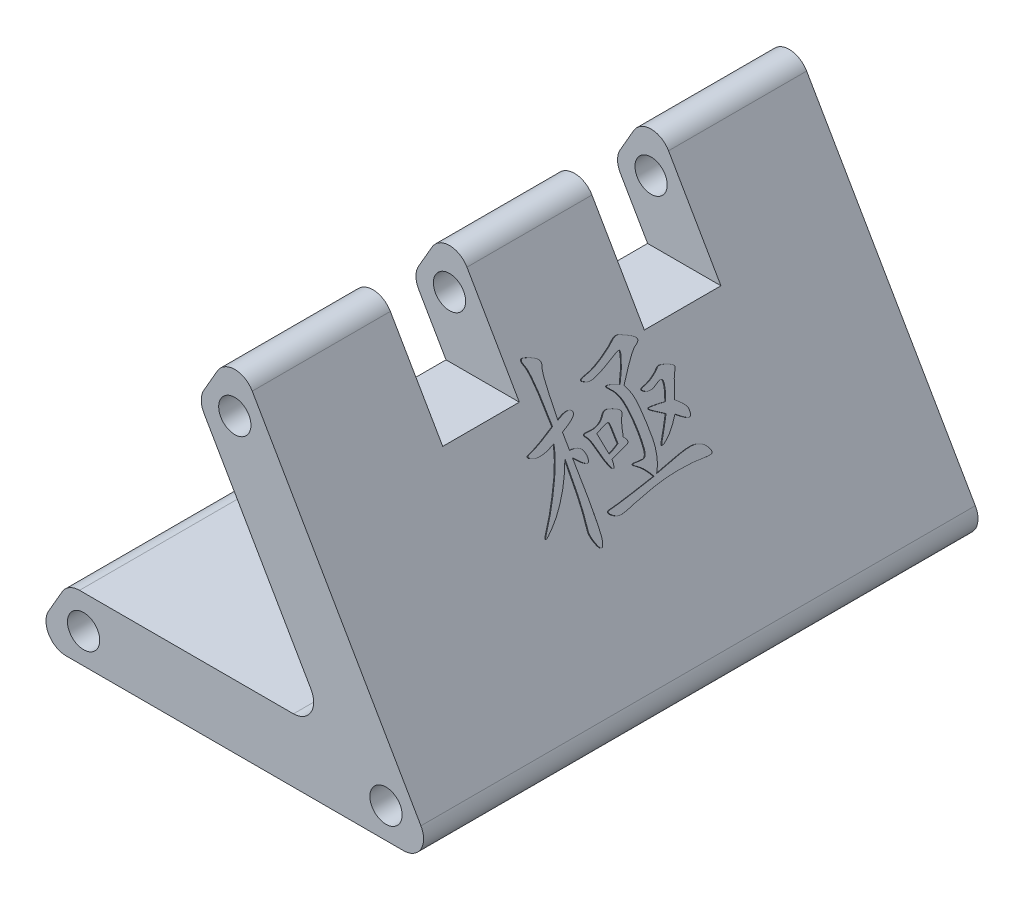
from build123d import *

# Parameters (mm, degrees)
SKETCH_1_R          = 1.6
EXTRUDE_1_DEPTH     = 27.5
FILLET_1_R          = 2
CUT_EXTRUDE_1_DEPTH = 66.5
FILLET_2_R          = 2
EXTRUDE_2_DEPTH     = 0.1
SKETCH_4_W          = 7.6
SKETCH_4_H          = 20
CUT_EXTRUDE_2_DEPTH = 25


with BuildPart() as part:
    # 草图1 → 凸台-拉伸1 (new, symmetric)
    with BuildSketch(Plane.XY):
        Polygon((20.196152423, -28.980762114), (0, 6), (-20.196152423, -28.980762114), align=None)
        Circle(SKETCH_1_R, mode=Mode.SUBTRACT)
        with Locations((-15, -25.980762114)):
            Circle(SKETCH_1_R, mode=Mode.SUBTRACT)
        with Locations((15, -25.980762114)):
            Circle(SKETCH_1_R, mode=Mode.SUBTRACT)
    extrude(amount=EXTRUDE_1_DEPTH, both=True)

    # 圆角1
    fillet_1_edges = [part.edges().sort_by_distance(p)[0] for p in [
        (-20.196152423, -28.980762114, 0),
        (0, 6, 0),
        (20.196152423, -28.980762114, 0),
    ]]
    fillet(fillet_1_edges, radius=FILLET_1_R)

    # 草图2 → 切除-拉伸1 (cut, symmetric)
    with BuildSketch(Plane(origin=(0, 0, -27.5), x_dir=(-1, 0, 0), z_dir=(0, 0, -1))):
        Polygon((3.637306696, -0.3), (-9.284232335, -22.680762114), (16.558845727, -22.680762114), align=None)
    extrude(amount=CUT_EXTRUDE_1_DEPTH, both=True, mode=Mode.SUBTRACT)

    # 圆角2
    fillet_2_edges = [part.edges().sort_by_distance(p)[0] for p in [
        (-3.637306696, -0.3, 0),
        (-16.558845727, -22.680762114, 0),
        (9.284232335, -22.680762114, 0),
    ]]
    fillet(fillet_2_edges, radius=FILLET_2_R)

    # 草图3 → 凸台-拉伸2 (add, symmetric)
    # profile 1 of 4: a face of its own
    with BuildSketch(Plane(origin=(2.598076211, 1.5, 0), x_dir=(0, 0, -1), z_dir=(0.8660254037844386, 0.5000000000000001, 0))):
        with BuildLine():
            add(Edge.make_bspline(
                [(2.736842105, -11.381173615), (2.801991454, -11.497126082), (2.929682208, -11.724389415), (3.085120059, -12.075523331), (3.193718681, -12.429488031), (3.256485862, -12.730112981), (3.29011482, -12.987916168), (3.313186965, -13.214143189), (3.333687441, -13.474998217), (3.351654391, -13.769617528), (3.366127131, -14.098938608), (3.383626882, -14.460960907), (3.391125932, -14.85791078), (3.40520759, -15.278842295), (3.401922108, -15.705724223), (3.371922554, -16.119384477), (3.311446119, -16.509218732), (3.22833647, -16.878342951), (3.108315326, -17.221984812), (2.97041173, -17.545865882), (2.800400711, -17.846024644), (2.66432259, -18.027536725), (2.596491228, -18.11801572)],
                knots=[0, 0, 0, 0, 1.136628238, 2.227757004, 3.274841286, 4.295935326, 4.848963795, 5.496727819, 6.239698062, 7.085576876, 8.019795436, 9.057592931, 10.183700872, 11.413460527, 12.657763562, 13.831288076, 14.955177659, 16.027648076, 17.060492108, 18.062143739, 19.034029657, 20, 20, 20, 20], degree=3))
            add(Edge.make_bspline(
                [(2.596491228, -18.11801572), (2.853723167, -18.073369607), (3.344469328, -17.988193914), (4.046248622, -17.873796403), (4.677787517, -17.777021229), (5.160558019, -17.709898794), (5.510465418, -17.664854849), (5.745500236, -17.644485104), (5.962150749, -17.631251498), (6.159835357, -17.624789808), (6.339436685, -17.630335574), (6.499889707, -17.643120636), (6.6430527, -17.661674597), (6.805396405, -17.704877093), (6.987636527, -17.770881177), (7.184213208, -17.876630845), (7.361237511, -18.000934423), (7.508902952, -18.148444398), (7.629703359, -18.301723709), (7.720700796, -18.452609383), (7.777439867, -18.60188845), (7.785557085, -18.701521307), (7.789473684, -18.749594667)],
                knots=[0, 0, 0, 0, 2.716065202, 5.181699354, 7.39712167, 9.362635088, 10.252514407, 11.066890192, 11.816332215, 12.510573645, 13.123728299, 13.684353632, 14.185289706, 14.622493898, 15.429504603, 16.195616628, 16.938471817, 17.67141889, 18.358367172, 18.964325239, 19.500281664, 20, 20, 20, 20], degree=3))
            add(Edge.make_bspline(
                [(7.789473684, -18.749594667), (7.785975484, -18.766222387), (7.778416926, -18.802149885), (7.724299236, -18.839168236), (7.648908836, -18.864093288), (7.542635128, -18.873225444), (7.409197832, -18.879543713), (7.245764183, -18.869913791), (7.053732827, -18.847504464), (6.748181589, -18.807909918), (6.321522729, -18.749974838), (5.761877872, -18.709216123), (5.145600849, -18.682659521), (4.715650315, -18.680530512), (4.49122807, -18.679419229)],
                knots=[0, 0, 0, 0, 0.176134878, 0.380574459, 0.656581553, 1.030796211, 1.513875527, 2.090102544, 2.781056321, 3.585908988, 5.391351152, 7.393452033, 9.595509816, 12, 12, 12, 12], degree=3))
            add(Edge.make_bspline(
                [(4.49122807, -18.679419229), (4.265924864, -18.682040004), (3.809795623, -18.687345796), (3.116121084, -18.727463093), (2.405586922, -18.796215158), (1.806499715, -18.871507286), (1.333039295, -18.939984395), (0.996369129, -18.993363432), (0.679761984, -19.041226097), (0.383793524, -19.091774501), (0.108768487, -19.137226777), (-0.14501372, -19.184523926), (-0.377897351, -19.231409879), (-0.651183967, -19.288128695), (-0.950870391, -19.352215833), (-1.270047941, -19.38905987), (-1.531946812, -19.409004229), (-1.747892364, -19.38809461), (-1.933123425, -19.336747723), (-2.101801713, -19.250224728), (-2.268952645, -19.139514464), (-2.397434763, -19.026173266), (-2.4836505, -18.929927938), (-2.52480624, -18.865513298), (-2.539060715, -18.806485511), (-2.522260641, -18.751748373), (-2.468818811, -18.717221098), (-2.394316116, -18.697014554), (-2.293842533, -18.681076495), (-2.21796165, -18.680014412), (-2.175438596, -18.679419229)],
                knots=[0, 0, 0, 0, 2.452300227, 4.964713367, 7.560189569, 10.221188635, 11.536149432, 12.767176317, 13.931526762, 15.02139617, 16.035305026, 16.965648597, 17.831172724, 18.620890509, 20.004269363, 21.163414613, 22.117029218, 22.856441957, 23.513178025, 24.19639443, 24.910415406, 25.691983384, 26.053049708, 26.315066214, 26.516660444, 26.695585537, 26.897400209, 27.174750135, 27.537536417, 28, 28, 28, 28], degree=3))
            add(Edge.make_bspline(
                [(-2.175438596, -18.679419229), (-2.147713216, -18.678618123), (-2.083574816, -18.676764889), (-1.973456389, -18.671782131), (-1.837534815, -18.66057375), (-1.67470078, -18.647200399), (-1.486332698, -18.633627655), (-1.272073007, -18.606769029), (-1.030782853, -18.586000119), (-0.763145999, -18.556579951), (-0.469598981, -18.522352552), (-0.149066092, -18.485761979), (0.197698245, -18.447825113), (0.571035332, -18.403012029), (0.969440089, -18.353501851), (1.394770315, -18.301069982), (1.846373581, -18.247484583), (2.156403889, -18.208323662), (2.315789474, -18.188191158)],
                knots=[0, 0, 0, 0, 0.294626454, 0.681572966, 1.170697032, 1.743109613, 2.41716358, 3.176307068, 4.036145648, 4.98940191, 6.036152897, 7.175379315, 8.416227613, 9.741463661, 11.169407057, 12.680677635, 14.293547043, 16, 16, 16, 16], degree=3))
            add(Edge.make_bspline(
                [(2.315789474, -18.188191158), (2.235201176, -18.055623904), (2.081101101, -17.802130226), (1.819483938, -17.466074098), (1.553183261, -17.182768823), (1.317632044, -16.998768193), (1.147390475, -16.87903752), (1.054292788, -16.804369993), (0.996495182, -16.7441399), (0.959000838, -16.697119269), (0.968341377, -16.646303045), (1.024513843, -16.632417303), (1.09706398, -16.632969304), (1.235563137, -16.648700084), (1.415728403, -16.676796554), (1.622556552, -16.695850571), (1.80270064, -16.710378726), (1.913771824, -16.713205444), (1.964912281, -16.714506948)],
                knots=[0, 0, 0, 0, 2.421572679, 4.630505212, 6.640478363, 8.47927966, 9.283237027, 9.898374733, 10.329111469, 10.607781406, 10.788339595, 11.024690413, 11.403867442, 11.9613716, 13.176744018, 14.264816593, 15.201070272, 16, 16, 16, 16], degree=3))
            add(Edge.make_bspline(
                [(1.964912281, -16.714506948), (2.009804267, -16.71001934), (2.099949377, -16.701008023), (2.212660918, -16.606651136), (2.300240084, -16.469699956), (2.344498769, -16.318648037), (2.378638085, -16.173120497), (2.39784197, -16.037279254), (2.415803648, -15.882167641), (2.431916707, -15.708035614), (2.441276138, -15.513791458), (2.449057476, -15.299783889), (2.454204917, -15.065839447), (2.455479346, -14.903809756), (2.456140351, -14.819770106)],
                knots=[0, 0, 0, 0, 0.758365101, 1.522830919, 2.413832335, 3.528496084, 4.199585751, 4.982068385, 5.8804867, 6.880949527, 7.983140702, 9.218386144, 10.557265302, 12, 12, 12, 12], degree=3))
            add(Edge.make_bspline(
                [(2.456140351, -14.819770106), (2.454455783, -14.635175765), (2.451139057, -14.271729962), (2.415648542, -13.735907981), (2.362130041, -13.217962702), (2.286590132, -12.723411001), (2.184486463, -12.26227825), (2.030838874, -11.852355675), (1.834447433, -11.496553873), (1.627858097, -11.255379139), (1.467614739, -11.095030595), (1.37967094, -10.993325707), (1.322491322, -10.909897508), (1.287320778, -10.849366499), (1.28454722, -10.79372499), (1.329257548, -10.765194645), (1.393990309, -10.770591358), (1.517914332, -10.792780711), (1.70127659, -10.849708001), (1.938123663, -10.934014775), (2.19296252, -11.042420104), (2.365561727, -11.126514999), (2.456140351, -11.170647299)],
                knots=[0, 0, 0, 0, 1.990218653, 3.918520012, 5.787921151, 7.603368328, 9.311926223, 10.870042153, 12.309211141, 13.669217195, 14.277100266, 14.754371079, 15.117152714, 15.363791294, 15.513556588, 15.653688124, 15.868759472, 16.200502776, 17.016641159, 17.929733103, 18.913541207, 20, 20, 20, 20], degree=3))
            add(Edge.make_bspline(
                [(2.456140351, -11.170647299), (2.534044382, -11.056817564), (2.685811723, -10.835062208), (2.892979171, -10.504325767), (3.073416264, -10.186067563), (3.225036981, -9.886748704), (3.344278162, -9.616784058), (3.433945315, -9.39144546), (3.492325763, -9.213673235), (3.503940381, -9.108948455), (3.50877193, -9.065384141)],
                knots=[0, 0, 0, 0, 1.396397204, 2.720366181, 3.949753812, 5.099092354, 6.116144513, 6.935449391, 7.557159084, 8, 8, 8, 8], degree=3))
            add(Edge.make_bspline(
                [(3.50877193, -9.065384141), (3.506306125, -9.049644632), (3.501362765, -9.018090605), (3.454362522, -8.984932657), (3.386578694, -8.980481266), (3.297516094, -8.986262309), (3.183410754, -9.008951716), (3.045013615, -9.048729985), (2.880467356, -9.104016546), (2.501963711, -9.24678581), (1.930349285, -9.463826004), (1.298134346, -9.657906761), (0.835288948, -9.788445462), (0.544391506, -9.843016806), (0.307036104, -9.880801343), (0.11208528, -9.879610737), (-0.053336801, -9.848935209), (-0.205162793, -9.795996215), (-0.352124077, -9.721542215), (-0.46618343, -9.647672742), (-0.543855587, -9.585774808), (-0.57365535, -9.535453971), (-0.567770204, -9.481849763), (-0.520380617, -9.443414285), (-0.44926341, -9.414214062), (-0.35035741, -9.386256765), (-0.22061869, -9.364008087), (-0.00041358, -9.338237998), (0.313315575, -9.295435098), (0.717959194, -9.198690776), (1.15589734, -9.061475912), (1.613783614, -8.895654898), (2.056628054, -8.710708771), (2.457693649, -8.533707677), (2.796823091, -8.363801835), (3.073207799, -8.199742995), (3.302106622, -8.05626023), (3.511771881, -7.976831392), (3.697669599, -7.942457788), (3.867168224, -7.974224814), (4.030821698, -8.049732407), (4.225007872, -8.139627042), (4.451916285, -8.260602346), (4.699308791, -8.396906876), (4.934097264, -8.535696734), (5.119149013, -8.67256416), (5.243629288, -8.794526461), (5.30783066, -8.916845227), (5.291449976, -9.039385844), (5.204922471, -9.14389585), (5.060780839, -9.234456109), (4.895192498, -9.300166288), (4.722803761, -9.388717029), (4.55443195, -9.519342268), (4.343204056, -9.695379004), (4.097426819, -9.930387323), (3.809044003, -10.214752914), (3.485763687, -10.556137437), (3.123546742, -10.950234479), (2.870816269, -11.23187437), (2.736842105, -11.381173615)],
                knots=[0, 0, 0, 0, 0.184364429, 0.369607487, 0.633022986, 0.987380221, 1.442441407, 2.025545752, 2.716471861, 3.526270317, 6.883648343, 10.055881053, 11.466650148, 12.654198181, 13.609184751, 14.347962371, 14.982623857, 15.620941895, 16.272353277, 16.956271921, 17.250917204, 17.460299435, 17.628063516, 17.848771766, 18.146705195, 18.558299617, 19.076637796, 19.727051356, 21.220528632, 22.876118409, 24.715795186, 26.730039288, 28.722073042, 30.477809904, 31.994696383, 33.272349563, 34.339588, 35.228530643, 35.953926582, 36.576534257, 37.26242852, 38.114119639, 39.147239634, 40.348788354, 41.506846688, 42.420352537, 43.104903999, 43.594016143, 44.013426347, 44.504526312, 45.171131808, 46.041679059, 46.642070409, 47.491151998, 48.59150062, 49.945897393, 51.571798143, 53.455692421, 55.59103127, 58, 58, 58, 58], degree=3))
        make_face()
    # profile 2 of 4: a face of its own
    with BuildSketch(Plane(origin=(2.598076211, 1.5, 0), x_dir=(0, 0, -1), z_dir=(0.8660254037844386, 0.5000000000000001, 0))):
        with BuildLine():
            add(Edge.make_bspline(
                [(-3.719298246, -11.170647299), (-3.646765375, -11.14310885), (-3.507879924, -11.090378414), (-3.305657252, -11.025747194), (-3.121044857, -10.97553713), (-2.954472415, -10.941191525), (-2.804908681, -10.921355753), (-2.67271089, -10.919541807), (-2.556187397, -10.92614513), (-2.435569869, -10.964841855), (-2.318898455, -11.021198987), (-2.226198575, -11.126742326), (-2.21846925, -11.260819899), (-2.269065728, -11.370213756), (-2.34514505, -11.463986214), (-2.446073716, -11.535437363), (-2.572093516, -11.62160398), (-2.738793538, -11.699869611), (-2.933216937, -11.793994511), (-3.165514297, -11.884767028), (-3.430425325, -11.984109414), (-3.619479497, -12.048781679), (-3.719298246, -12.082928001)],
                knots=[0, 0, 0, 0, 1.344132713, 2.573736254, 3.677086762, 4.657469661, 5.519577382, 6.285332407, 6.948580662, 7.528048509, 8.468542532, 9.174262403, 9.837510658, 10.66548297, 11.209444983, 11.915164854, 12.793714883, 13.854474535, 15.0969319, 16.538154299, 18.172179431, 20, 20, 20, 20], degree=3))
            Line((-3.719298246, -12.082928001), (-3.719298246, -13.486436772))
            add(Edge.make_bspline(
                [(-3.719298246, -13.486436772), (-3.646366691, -13.492999619), (-3.507569874, -13.505489443), (-3.312146948, -13.542413416), (-3.137966078, -13.589023679), (-2.984625629, -13.646207201), (-2.855057515, -13.721724829), (-2.743831286, -13.803415872), (-2.655221848, -13.901166519), (-2.576642018, -14.046425548), (-2.509206157, -14.228889608), (-2.467505064, -14.446870705), (-2.469917715, -14.658854055), (-2.505108954, -14.819370993), (-2.565521204, -14.937996039), (-2.665312402, -14.957663507), (-2.776878536, -14.92248545), (-2.910852182, -14.838581983), (-3.074756528, -14.712855314), (-3.264381436, -14.534684561), (-3.483563034, -14.309157148), (-3.636726758, -14.139372311), (-3.719298246, -14.047840281)],
                knots=[0, 0, 0, 0, 1.171328436, 2.229167592, 3.177681634, 4.05567862, 4.838162783, 5.570257416, 6.257660978, 6.928361689, 8.200624651, 9.356422799, 10.465711916, 11.551884659, 12.021047472, 12.451533792, 13.036664375, 13.869028262, 14.967170212, 16.340998177, 18.027410028, 20, 20, 20, 20], degree=3))
            add(Edge.make_bspline(
                [(-3.719298246, -14.047840281), (-3.716535951, -14.269627552), (-3.711151725, -14.701932136), (-3.706017592, -15.331783727), (-3.703313478, -15.926113009), (-3.703197967, -16.483191716), (-3.705837788, -17.004747462), (-3.710504472, -17.48993068), (-3.71951457, -17.93867112), (-3.725283205, -18.351161286), (-3.739270236, -18.72713451), (-3.753860177, -19.067699253), (-3.773599409, -19.372512349), (-3.788766863, -19.641510862), (-3.814307003, -19.873388402), (-3.835168398, -20.069834007), (-3.863766263, -20.229260539), (-3.89974126, -20.386437974), (-3.94844462, -20.536036941), (-4.016441227, -20.669409596), (-4.079483611, -20.764390815), (-4.166681789, -20.802498963), (-4.257041723, -20.773867912), (-4.33354269, -20.689715554), (-4.417627876, -20.565106148), (-4.521805895, -20.33458207), (-4.641621584, -20.035540409), (-4.730647964, -19.687859489), (-4.773181843, -19.378976607), (-4.742031308, -19.094707935), (-4.679315865, -18.805327147), (-4.627027871, -18.467015299), (-4.57640279, -18.067302918), (-4.532933097, -17.689514239), (-4.499043232, -17.334182101), (-4.473134616, -17.003233399), (-4.45094791, -16.614080019), (-4.426764977, -16.168836386), (-4.407363225, -15.666232614), (-4.385506078, -15.107491416), (-4.368469688, -14.491433303), (-4.3569121, -14.061702228), (-4.350877193, -13.837313965)],
                knots=[0, 0, 0, 0, 1.899635201, 3.70274182, 5.394504534, 6.989791749, 8.473798405, 9.861406641, 11.145249343, 12.317811256, 13.394342094, 14.367373304, 15.237058707, 16.010478514, 16.674221123, 17.23470911, 17.70192975, 18.060090826, 18.616190495, 19.040945637, 19.346877623, 19.570093311, 19.800470217, 20.104959119, 20.526853049, 21.087684728, 22.26446484, 23.2830527, 24.15652815, 24.916302526, 25.716693682, 26.693790263, 27.846057099, 29.167744095, 29.950363181, 30.903009574, 32.010595707, 33.288571422, 34.721849667, 36.318240863, 38.077533643, 40, 40, 40, 40], degree=3))
            add(Edge.make_bspline(
                [(-4.350877193, -13.837313965), (-4.464832817, -14.049924), (-4.683326498, -14.457573462), (-5.031553044, -15.024694741), (-5.368699198, -15.530448202), (-5.707641464, -15.970800812), (-6.042307013, -16.359098037), (-6.369457435, -16.710014413), (-6.690709366, -17.027999914), (-7.009031996, -17.31004179), (-7.321938963, -17.558223833), (-7.623273983, -17.784299376), (-7.917714579, -17.979287042), (-8.150712175, -18.129074966), (-8.311880454, -18.20275346), (-8.387605435, -18.246306253), (-8.449375242, -18.215956796), (-8.409850324, -18.139622513), (-8.357294456, -18.054634808), (-8.25002931, -17.919805686), (-8.109364572, -17.748529959), (-7.843739483, -17.467234943), (-7.483543833, -17.05100448), (-7.033457941, -16.490861624), (-6.572889657, -15.85529027), (-6.180581485, -15.287985476), (-5.869749346, -14.813103819), (-5.654550387, -14.457323043), (-5.458700979, -14.110577839), (-5.282021677, -13.772468525), (-5.122398755, -13.444223411), (-4.987584472, -13.122417575), (-4.869613782, -12.811429226), (-4.803958107, -12.604785826), (-4.771929825, -12.503980632)],
                knots=[0, 0, 0, 0, 1.787555884, 3.427383828, 4.930558968, 6.290703403, 7.543012355, 8.728821377, 9.845853481, 10.892131491, 11.878943357, 12.806210884, 13.680680274, 14.5044263, 14.834677217, 15.02167184, 15.110881082, 15.249500525, 15.520420605, 15.932693883, 16.48437586, 17.179819094, 18.790892251, 20.56795618, 22.502211626, 24.607576366, 25.679799977, 26.708390678, 27.688872596, 28.630963227, 29.535677514, 30.393195816, 31.216165586, 32, 32, 32, 32], degree=3))
            add(Edge.make_bspline(
                [(-4.771929825, -12.503980632), (-4.890298556, -12.541464385), (-5.11786022, -12.613526196), (-5.449876389, -12.699572897), (-5.758655656, -12.761431589), (-6.043771474, -12.794802566), (-6.304623668, -12.807557502), (-6.541920184, -12.792628327), (-6.755454464, -12.752394957), (-6.94044614, -12.687610933), (-7.09068421, -12.613953662), (-7.20293297, -12.543733615), (-7.279727626, -12.486015217), (-7.314004214, -12.420340265), (-7.290790733, -12.356964066), (-7.220955483, -12.316852825), (-7.117346449, -12.281408209), (-6.969522709, -12.258020639), (-6.781151251, -12.222843138), (-6.554097658, -12.160094713), (-6.2851381, -12.082592994), (-5.976795726, -11.983147985), (-5.627270514, -11.863601727), (-5.238658953, -11.718827359), (-4.807141271, -11.559276976), (-4.507502058, -11.442312363), (-4.350877193, -11.381173615)],
                knots=[0, 0, 0, 0, 1.529679857, 2.940780802, 4.224155124, 5.40659462, 6.474964171, 7.437861128, 8.329732155, 9.143358556, 9.845163989, 10.387184599, 10.772822402, 11.02656803, 11.229114927, 11.534431934, 11.976775273, 12.586007998, 13.369014705, 14.339984805, 15.485215921, 16.818756485, 18.331166932, 20.036688515, 21.928331474, 24, 24, 24, 24], degree=3))
            add(Edge.make_bspline(
                [(-4.350877193, -11.381173615), (-4.351889362, -11.21570009), (-4.35386071, -10.893416332), (-4.354316265, -10.422933919), (-4.364398185, -9.978541106), (-4.369932116, -9.559991135), (-4.383982654, -9.167553437), (-4.399135799, -8.801049408), (-4.417402518, -8.45968327), (-4.437718238, -8.144264853), (-4.461274858, -7.854011565), (-4.486591646, -7.590516938), (-4.515385703, -7.352230069), (-4.545864231, -7.139765723), (-4.579616112, -6.952519283), (-4.614382743, -6.790501198), (-4.656077225, -6.655459656), (-4.709900532, -6.516009297), (-4.770846762, -6.37796413), (-4.810141129, -6.234678538), (-4.819508738, -6.122524032), (-4.787387662, -6.034840181), (-4.709321282, -5.987935748), (-4.602690645, -5.990799775), (-4.468953481, -6.022223429), (-4.25734765, -6.107117064), (-3.999779763, -6.226351154), (-3.725938942, -6.366392417), (-3.518815242, -6.501875398), (-3.37261774, -6.631201864), (-3.281889335, -6.758806592), (-3.239862248, -6.887352239), (-3.239555864, -7.019573275), (-3.290899404, -7.121577521), (-3.337166404, -7.216149881), (-3.368152251, -7.314696243), (-3.403342517, -7.435437531), (-3.433642228, -7.581518239), (-3.460227328, -7.752840234), (-3.493095798, -7.947275947), (-3.520946624, -8.165797728), (-3.546041817, -8.407720993), (-3.572951928, -8.672682634), (-3.595235333, -8.961370758), (-3.618665746, -9.273255096), (-3.64284064, -9.608443595), (-3.662278147, -9.966393514), (-3.684389077, -10.347484337), (-3.70133863, -10.751319185), (-3.713212944, -11.028565293), (-3.719298246, -11.170647299)],
                knots=[0, 0, 0, 0, 2.055143435, 4.002690769, 5.842893852, 7.575516859, 9.201131961, 10.719631905, 12.131172114, 13.446682748, 14.644936182, 15.747694076, 16.733960293, 17.62565864, 18.412888286, 19.096789699, 19.682184248, 20.165775575, 20.953005221, 21.553242013, 22.005280251, 22.333055991, 22.652423531, 23.061860544, 23.623227544, 24.358679379, 25.88497406, 27.150836614, 28.174429145, 28.951072589, 29.562867234, 30.09370658, 30.610287407, 31.155755536, 31.487917018, 31.920052575, 32.434387388, 33.050612994, 33.770553097, 34.587799632, 35.499336611, 36.505763026, 37.60852092, 38.806774354, 40.101572579, 41.492956333, 42.98029694, 44.553579285, 46.233791735, 48, 48, 48, 48], degree=3))
        make_face()
    # profile 3 of 4: a face of its own
    with BuildSketch(Plane(origin=(2.598076211, 1.5, 0), x_dir=(0, 0, -1), z_dir=(0.8660254037844386, 0.5000000000000001, 0))):
        with BuildLine():
            add(Edge.make_bspline(
                [(1.052631579, -14.60924379), (1.088815299, -14.647612832), (1.154717767, -14.717495492), (1.235552705, -14.82111952), (1.284877018, -14.915035511), (1.30537681, -14.999761022), (1.288720392, -15.076023742), (1.236109349, -15.136750027), (1.153302107, -15.178997834), (1.045367978, -15.210864675), (0.912947703, -15.236466524), (0.760200387, -15.270004424), (0.588696301, -15.313709649), (0.39619813, -15.355278212), (0.185876981, -15.410005475), (-0.046380437, -15.462424683), (-0.297181403, -15.525790491), (-0.471290807, -15.569221578), (-0.561403509, -15.59169993)],
                knots=[0, 0, 0, 0, 1.021282207, 1.86009117, 2.53531936, 3.065032368, 3.512676664, 3.989545277, 4.568019465, 5.289590219, 6.164850294, 7.17838702, 8.317685997, 9.591460977, 10.991141358, 12.525221823, 14.201581064, 16, 16, 16, 16], degree=3))
            add(Edge.make_bspline(
                [(-0.561403509, -15.59169993), (-0.563236756, -15.656684535), (-0.566618169, -15.776548246), (-0.582151464, -15.942713485), (-0.616008635, -16.078105503), (-0.652006024, -16.170857663), (-0.691494541, -16.221430588), (-0.731171654, -16.236647245), (-0.772164269, -16.213999158), (-0.814360932, -16.176309984), (-0.857287354, -16.112711167), (-0.909139316, -16.031490408), (-0.963679051, -15.924862531), (-1.044380881, -15.748341392), (-1.143735669, -15.494346821), (-1.261522493, -15.161126623), (-1.372712422, -14.79232373), (-1.471804031, -14.403254426), (-1.571285771, -14.028259112), (-1.690850674, -13.705032961), (-1.81386172, -13.443353547), (-1.932739442, -13.276740115), (-2.020869782, -13.177982037), (-2.051603282, -13.114753965), (-2.060180485, -13.057597316), (-2.02600225, -13.013451305), (-1.965558415, -12.994205494), (-1.884150334, -12.981403133), (-1.775708491, -12.984041276), (-1.599478479, -12.999783506), (-1.370178568, -13.019881912), (-1.102817878, -13.018890455), (-0.857367581, -12.988566), (-0.634762909, -12.930054065), (-0.432628153, -12.853951121), (-0.256636096, -12.752175586), (-0.094911898, -12.64316492), (0.029683935, -12.506677518), (0.149995994, -12.384372761), (0.280997923, -12.295984036), (0.421947137, -12.256261596), (0.569145987, -12.254695562), (0.73110418, -12.290799389), (0.916791479, -12.358303804), (1.133920735, -12.452937596), (1.326724348, -12.551651153), (1.4839494, -12.63744227), (1.577043876, -12.714541837), (1.651357684, -12.788175552), (1.69485639, -12.869977969), (1.714077234, -12.952582942), (1.709010606, -13.039068033), (1.672535817, -13.125171564), (1.610646219, -13.210746062), (1.538550895, -13.307941178), (1.468920551, -13.429372883), (1.39969391, -13.572185269), (1.329184067, -13.736895836), (1.260021333, -13.923708558), (1.189526603, -14.132502848), (1.119913319, -14.363232433), (1.075644095, -14.525100005), (1.052631579, -14.60924379)],
                knots=[0, 0, 0, 0, 1.144377244, 2.110796909, 2.927997373, 3.596746651, 3.844936337, 4.037786843, 4.284096277, 4.608234322, 5.04428548, 5.619613846, 6.308396647, 7.147490286, 9.03586261, 11.104459612, 13.366500281, 15.810932749, 18.171136568, 20.187554386, 21.871687062, 23.238155722, 23.781056443, 24.183566913, 24.473645103, 24.73595015, 25.084284292, 25.563023778, 26.188116797, 26.983259805, 28.679974407, 30.235158603, 31.679929419, 33.018557141, 34.278466635, 35.466103249, 36.591535084, 37.69116353, 38.704775958, 39.609838814, 40.434965205, 41.243156097, 42.17604239, 43.338056711, 44.71739291, 46.340161453, 47.153369986, 47.858165374, 48.462267853, 48.980637674, 49.465168574, 49.938782484, 50.479538192, 51.084217564, 51.794924666, 52.608133199, 53.542264503, 54.587266928, 55.759637022, 57.04692318, 58.464899068, 60, 60, 60, 60], degree=3))
        make_face()
        with BuildLine():
            add(Edge.make_bspline(
                [(-0.98245614, -13.416261334), (-0.948682808, -13.5930024), (-0.884931729, -13.926621641), (-0.794902399, -14.396545484), (-0.71241574, -14.80478224), (-0.657022803, -15.055489123), (-0.631578947, -15.170647299)],
                knots=[0, 0, 0, 0, 1.206823894, 2.278019932, 3.20903614, 4, 4, 4, 4], degree=3))
            add(Edge.make_bspline(
                [(-0.631578947, -15.170647299), (-0.565586071, -15.154758613), (-0.417776127, -15.11917135), (-0.176172237, -15.045810465), (0.107904953, -14.94200818), (0.311193472, -14.862653937), (0.421052632, -14.819770106)],
                knots=[0, 0, 0, 0, 0.733245963, 1.64231431, 2.725882946, 4, 4, 4, 4], degree=3))
            add(Edge.make_bspline(
                [(0.421052632, -14.819770106), (0.421307284, -14.725335208), (0.421793237, -14.545124788), (0.41853673, -14.28955463), (0.415889391, -14.062565838), (0.413951011, -13.864150057), (0.409343985, -13.694253632), (0.40093458, -13.552283175), (0.393545208, -13.439448313), (0.384564934, -13.333079261), (0.366868026, -13.230306503), (0.293269362, -13.145558469), (0.185987113, -13.11276408), (0.052198365, -13.137162244), (-0.120729585, -13.18614809), (-0.354343512, -13.243549752), (-0.646773929, -13.326656173), (-0.8636604, -13.384550653), (-0.98245614, -13.416261334)],
                knots=[0, 0, 0, 0, 1.5062814, 2.874441638, 4.076782357, 5.12712452, 6.039603481, 6.786985338, 7.396437214, 7.840587326, 8.497539623, 9.016262154, 9.540659954, 10.207565547, 11.149395449, 12.41970034, 14.038953987, 16, 16, 16, 16], degree=3))
        make_face(mode=Mode.SUBTRACT)
    # profile 4 of 4: a face of its own
    with BuildSketch(Plane(origin=(2.598076211, 1.5, 0), x_dir=(0, 0, -1), z_dir=(0.8660254037844386, 0.5000000000000001, 0))):
        with BuildLine():
            add(Edge.make_bspline(
                [(6.385964912, -14.11801572), (6.451957025, -14.175016527), (6.577353184, -14.283327686), (6.753319731, -14.440053003), (6.900050226, -14.592095817), (7.020625788, -14.734832155), (7.123413359, -14.863274315), (7.192942599, -14.987103109), (7.243606011, -15.098665716), (7.268587104, -15.23106996), (7.27095948, -15.373720013), (7.254464821, -15.524716512), (7.203527157, -15.644318006), (7.141446251, -15.728449925), (7.057771263, -15.76115729), (6.971897369, -15.737881324), (6.865001977, -15.696161943), (6.733793376, -15.620594959), (6.576139237, -15.518543612), (6.396373315, -15.381603434), (6.187391704, -15.218274578), (6.042453261, -15.09581264), (5.964912281, -15.030296422)],
                knots=[0, 0, 0, 0, 1.548831541, 2.943041473, 4.183588614, 5.296789268, 6.263118343, 7.097149911, 7.814426171, 8.427018038, 9.473792862, 10.344218317, 11.095827042, 11.771809223, 12.132011848, 12.615176385, 13.292383332, 14.187616017, 15.28873432, 16.630502992, 18.197344366, 20, 20, 20, 20], degree=3))
            add(Edge.make_bspline(
                [(5.964912281, -15.030296422), (5.839173325, -15.174729837), (5.597061088, -15.452838533), (5.208091655, -15.816202155), (4.822736839, -16.123393517), (4.497639555, -16.32393242), (4.263552575, -16.449422494), (4.125494674, -16.50866523), (4.03248732, -16.538784782), (3.958054783, -16.550663072), (3.923667508, -16.496789735), (3.960599305, -16.426396549), (4.016301779, -16.334917857), (4.152965902, -16.160149474), (4.362824635, -15.90227052), (4.635663169, -15.54040077), (4.941397585, -15.128807741), (5.151863004, -14.834859921), (5.263157895, -14.679419229)],
                knots=[0, 0, 0, 0, 1.891929086, 3.642937685, 5.25340187, 6.757660554, 7.405049174, 7.888613328, 8.219202083, 8.41636847, 8.539885434, 8.762229166, 9.123559934, 9.637421568, 10.929476779, 12.42657502, 14.110359672, 16, 16, 16, 16], degree=3))
            add(Edge.make_bspline(
                [(5.263157895, -14.679419229), (5.190500295, -14.629866413), (5.039430456, -14.526836091), (4.801022527, -14.369303609), (4.548908866, -14.193281669), (4.327627066, -14.049517088), (4.167833792, -13.932532851), (4.079275227, -13.857233114), (4.027621693, -13.799151657), (3.998074661, -13.743021546), (4.034065664, -13.697632971), (4.100741506, -13.685582236), (4.195844594, -13.685146011), (4.480736711, -13.71254463), (4.95747364, -13.78472505), (5.388986791, -13.865409704), (5.614035088, -13.907489404)],
                knots=[0, 0, 0, 0, 1.145609563, 2.381953899, 3.721674878, 5.152104561, 5.813426268, 6.309208874, 6.645881368, 6.860004646, 7.03844071, 7.298981807, 7.716689925, 8.282757073, 11.018269823, 14, 14, 14, 14], degree=3))
            add(Edge.make_bspline(
                [(5.614035088, -13.907489404), (5.678101471, -13.775716212), (5.796764543, -13.531647309), (5.936835551, -13.183018481), (6.027598502, -12.882129499), (6.069703178, -12.662539538), (6.072071903, -12.51501489), (6.046541252, -12.431998308), (5.99542952, -12.36979991), (5.916574978, -12.339458535), (5.817486186, -12.33687177), (5.699003248, -12.361339493), (5.556362632, -12.402660762), (5.40109779, -12.471530709), (5.237752165, -12.542328232), (5.072286348, -12.590135418), (4.916486849, -12.626710269), (4.76606506, -12.639295475), (4.623727205, -12.634764266), (4.487567546, -12.611696987), (4.361198918, -12.56685387), (4.246110966, -12.508379035), (4.152698583, -12.443611386), (4.080966657, -12.384791338), (4.041342171, -12.330079316), (4.026069327, -12.273837158), (4.06256572, -12.228884185), (4.120531879, -12.197323661), (4.206932194, -12.16830843), (4.36240693, -12.146654687), (4.573107795, -12.113411145), (4.823509039, -12.049004757), (5.06592936, -11.972757186), (5.293809205, -11.876233768), (5.50199514, -11.774539357), (5.684264801, -11.674880991), (5.839447341, -11.585324895), (5.959886612, -11.488291613), (6.085826681, -11.406751689), (6.247367371, -11.39387307), (6.43262812, -11.416136109), (6.634344069, -11.486860792), (6.838475857, -11.572408593), (7.029794241, -11.655337727), (7.191502755, -11.745256819), (7.325479802, -11.829504585), (7.431637113, -11.919009608), (7.468852493, -12.044146109), (7.428072948, -12.177059469), (7.325561515, -12.300719869), (7.208780224, -12.445654312), (7.101551377, -12.621382324), (6.998813952, -12.817145567), (6.907990097, -13.03804184), (6.810837574, -13.280033241), (6.689588231, -13.540725939), (6.54689265, -13.823009412), (6.441100257, -14.016943807), (6.385964912, -14.11801572)],
                knots=[0, 0, 0, 0, 2.466841638, 4.569057825, 6.318525616, 7.752734265, 8.321873773, 8.783203466, 9.186702153, 9.631113763, 10.157110541, 10.83825567, 11.659888903, 12.654158747, 13.694454646, 14.654419552, 15.550040982, 16.384780061, 17.187679297, 17.943190302, 18.699827256, 19.437089263, 20.108795435, 20.615208535, 20.98340628, 21.249621894, 21.512620284, 21.872930292, 22.36657462, 23.033351647, 24.513134503, 25.956735291, 27.382311224, 28.788421121, 30.119419247, 31.281384109, 32.289682395, 33.124166474, 33.895015122, 34.763614528, 35.776965917, 37.031918359, 38.340420484, 39.509142605, 40.540707158, 41.447076194, 42.189802672, 42.813024768, 43.520681059, 44.431383731, 45.502324619, 46.655925615, 47.889152301, 49.222387132, 50.674513485, 52.280311957, 54.061426979, 56, 56, 56, 56], degree=3))
        make_face()
    extrude(amount=EXTRUDE_2_DEPTH, both=True)

    # 草图4 → 切除-拉伸2 (cut, symmetric)
    with BuildSketch(Plane(origin=(0, 0, 0), x_dir=(0, 0, -1), z_dir=(1, 0, 0))):
        with Locations((-10, 4)):
            Rectangle(SKETCH_4_W, SKETCH_4_H)
        with Locations((10, 4)):
            Rectangle(SKETCH_4_W, SKETCH_4_H)
    extrude(amount=CUT_EXTRUDE_2_DEPTH, both=True, mode=Mode.SUBTRACT)


solid = part.part
